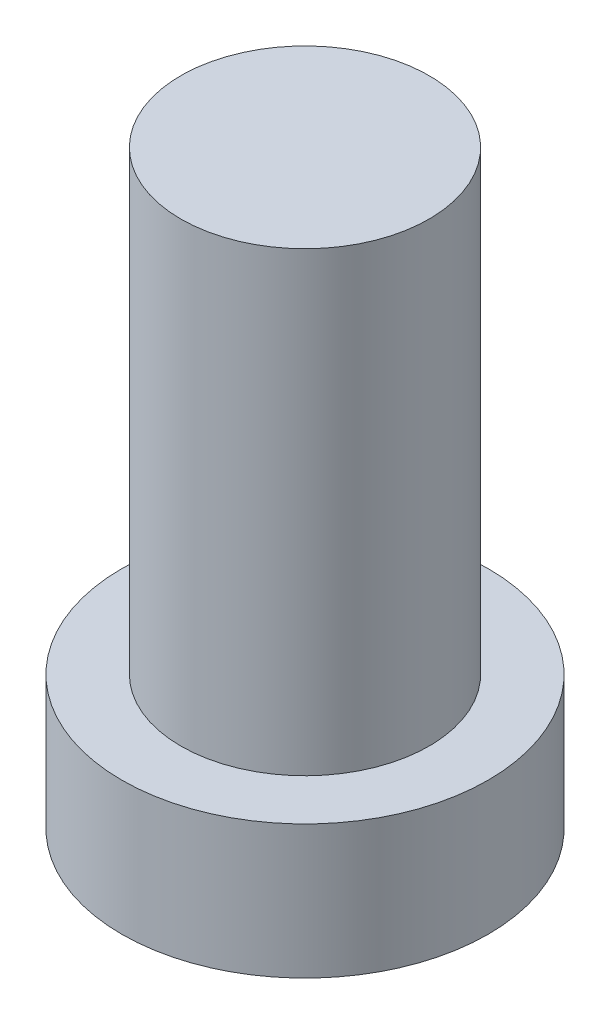
from build123d import *

# Parameters (mm, degrees)
SKETCH_1_R      = 5.9
EXTRUDE_1_DEPTH = 4.3
SKETCH_2_R      = 4
EXTRUDE_2_DEPTH = 14.7


with BuildPart() as part:
    # 草图1 → 凸台-拉伸1 (new body)
    with BuildSketch(Plane(origin=(0, 0, 0), x_dir=(1, 0, 0), z_dir=(0, 1, 0))):
        with Locations(Location((0, 0, 0), (0, 0, 90))):
            Circle(SKETCH_1_R)
    extrude(amount=EXTRUDE_1_DEPTH)

    # 草图2 → 凸台-拉伸2 (add)
    with BuildSketch(Plane(origin=(0, 4.3, 0), x_dir=(1, 0, 0), z_dir=(0, 1, 0))):
        with Locations(Location((0, 0, 0), (0, 0, 270))):
            Circle(SKETCH_2_R)
    extrude(amount=EXTRUDE_2_DEPTH)


solid = part.part
